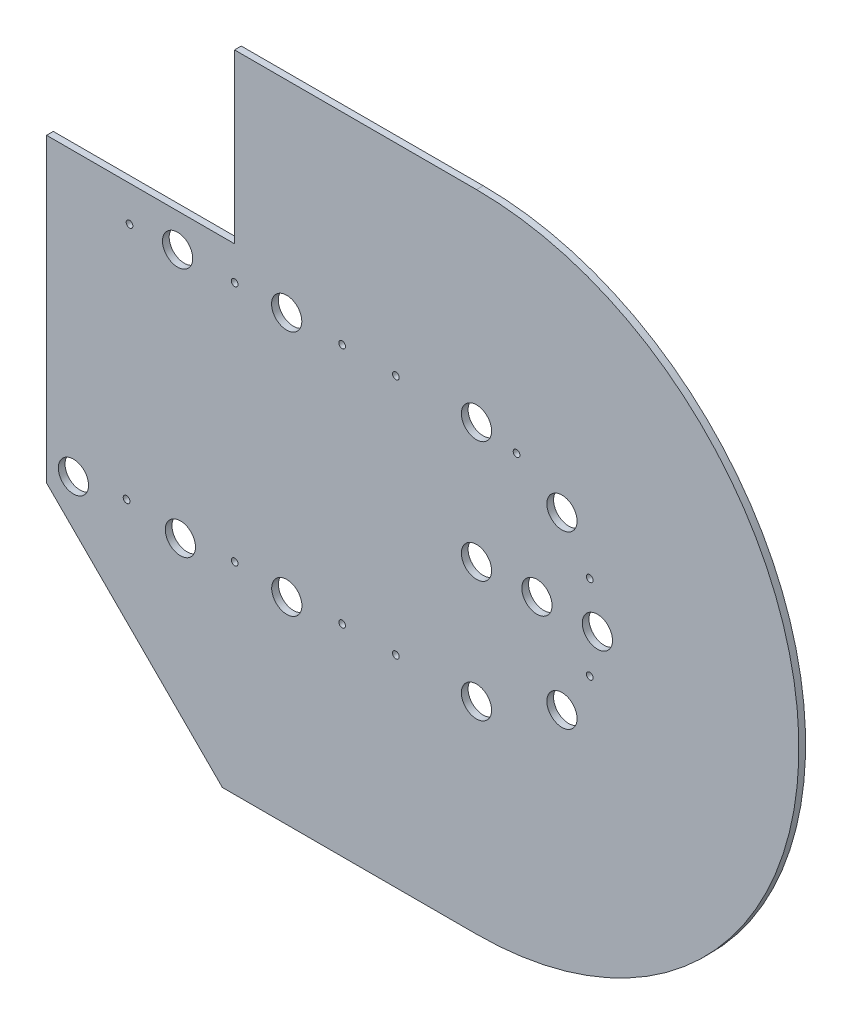
from build123d import *

# Parameters (mm, degrees)
MODEL_R             = 14.2875
MODEL_R_2           = 3.175
BOSS_EXTRUDE1_DEPTH = 6.35
SKETCH2_W           = 177.682226564
SKETCH2_H           = 158.75
CUT_EXTRUDE1_DEPTH  = 6.35


with BuildPart() as part:
    # Model → Boss-Extrude1 (new body)
    with BuildSketch(Plane.XY):
        with BuildLine():
            Line((0, 304.8), (-406.4, 304.8))
            Line((-406.4, 304.8), (-406.4, -120.65))
            Line((-406.4, -120.65), (-406.4, -138.610512242))
            Line((-406.4, -138.610512242), (-240.210512242, -304.8))
            Line((-240.210512242, -304.8), (-222.25, -304.8))
            Line((-222.25, -304.8), (0, -304.8))
            ThreePointArc((0, -304.8), (304.8, 0), (0, 304.8))
        make_face()
        with Locations((-282.557162358, 114.3)):
            Circle(MODEL_R, mode=Mode.SUBTRACT)
        with Locations((-179.408571771, 114.3)):
            Circle(MODEL_R, mode=Mode.SUBTRACT)
        with Locations((0, 114.3)):
            Circle(MODEL_R, mode=Mode.SUBTRACT)
        with Locations((80.82230509, 80.82230509)):
            Circle(MODEL_R, mode=Mode.SUBTRACT)
        with Locations((114.3, 0)):
            Circle(MODEL_R, mode=Mode.SUBTRACT)
        with Locations((80.82230509, -80.82230509)):
            Circle(MODEL_R, mode=Mode.SUBTRACT)
        with Locations((0, -114.3)):
            Circle(MODEL_R, mode=Mode.SUBTRACT)
        with Locations((-179.316283411, -118.368022334)):
            Circle(MODEL_R, mode=Mode.SUBTRACT)
        with Locations((-381, -120.65)):
            Circle(MODEL_R, mode=Mode.SUBTRACT)
        with Locations((-279.904657875, -120.65)):
            Circle(MODEL_R, mode=Mode.SUBTRACT)
        Circle(MODEL_R, mode=Mode.SUBTRACT)
        with Locations((57.15, 0)):
            Circle(MODEL_R, mode=Mode.SUBTRACT)
        with Locations((37.893602924, 107.835823628)):
            Circle(MODEL_R_2, mode=Mode.SUBTRACT)
        with Locations((107.090214294, 39.952171435)):
            Circle(MODEL_R_2, mode=Mode.SUBTRACT)
        with Locations((107.090214294, -39.952171435)):
            Circle(MODEL_R_2, mode=Mode.SUBTRACT)
        with Locations((-327.981609649, 112.531845238)):
            Circle(MODEL_R_2, mode=Mode.SUBTRACT)
        with Locations((-330.785746456, -114.289302148)):
            Circle(MODEL_R_2, mode=Mode.SUBTRACT)
        with Locations((-228.6, 114.3)):
            Circle(MODEL_R_2, mode=Mode.SUBTRACT)
        with Locations((-127, 114.3)):
            Circle(MODEL_R_2, mode=Mode.SUBTRACT)
        with Locations((-76.2, 114.3)):
            Circle(MODEL_R_2, mode=Mode.SUBTRACT)
        with Locations((-76.2, -114.3)):
            Circle(MODEL_R_2, mode=Mode.SUBTRACT)
        with Locations((-127, -114.3)):
            Circle(MODEL_R_2, mode=Mode.SUBTRACT)
        with Locations((-228.6, -114.3)):
            Circle(MODEL_R_2, mode=Mode.SUBTRACT)
    extrude(amount=BOSS_EXTRUDE1_DEPTH)

    # Sketch2 → Cut-Extrude1 (cut)
    with BuildSketch(Plane.XY.offset(6.35)):
        with Locations((-317.558886718, 225.425)):
            Rectangle(SKETCH2_W, SKETCH2_H)
    extrude(amount=-CUT_EXTRUDE1_DEPTH, mode=Mode.SUBTRACT)


solid = part.part
